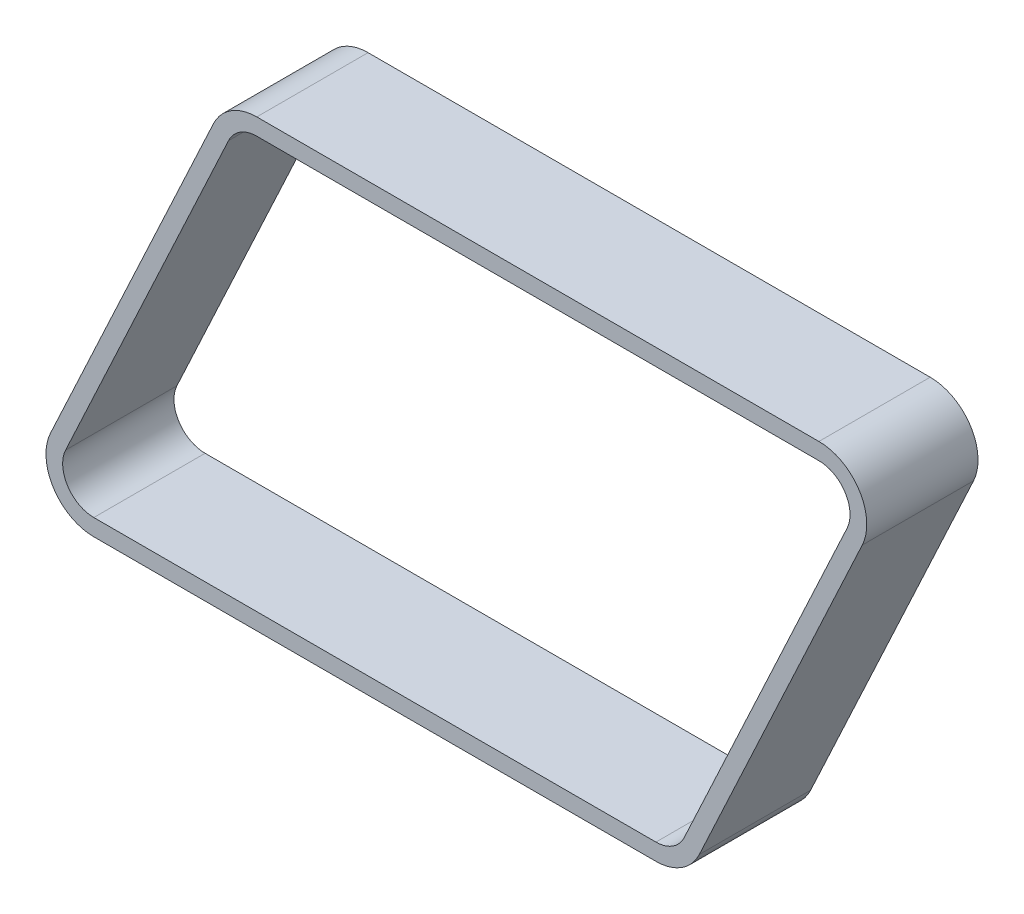
from build123d import *

# Parameters (mm, degrees)
BOSS_EXTRUDE1_DEPTH = 10


with BuildPart() as part:
    # Sketch1 → Boss-Extrude1 (new body)
    with BuildSketch(Plane.XY):
        with BuildLine():
            Line((6.747131567, 0), (57.259771997, 0))
            ThreePointArc((57.259771997, 0), (59.570856854, 0.673619806), (61.158070395, 2.483489977))
            Line((61.158070395, 2.483489977), (75.800845312, 33.885022121))
            ThreePointArc((75.800845312, 33.885022121), (75.530405908, 38.011130086), (71.90517476, 40))
            Line((71.90517476, 40), (21.392534329, 40))
            ThreePointArc((21.392534329, 40), (19.081449472, 39.326380194), (17.494235931, 37.516510023))
            Line((17.494235931, 37.516510023), (2.851461014, 6.114977879))
            ThreePointArc((2.851461014, 6.114977879), (3.121900418, 1.988869914), (6.747131567, 0))
        make_face()
        with BuildLine():
            ThreePointArc((4.210922695, 5.481050486), (4.386987587, 2.794819326), (6.747131567, 1.5))
            Line((6.747131567, 1.5), (57.259771997, 1.5))
            ThreePointArc((57.259771997, 1.5), (58.764907442, 1.938706975), (59.798608715, 3.11741737))
            Line((59.798608715, 3.11741737), (74.441383631, 34.518949514))
            ThreePointArc((74.441383631, 34.518949514), (74.265318739, 37.205180674), (71.90517476, 38.5))
            Line((71.90517476, 38.5), (21.392534329, 38.5))
            ThreePointArc((21.392534329, 38.5), (19.887398884, 38.061293025), (18.853697612, 36.88258263))
            Line((18.853697612, 36.88258263), (4.210922695, 5.481050486))
        make_face(mode=Mode.SUBTRACT)
    extrude(amount=BOSS_EXTRUDE1_DEPTH)


solid = part.part
